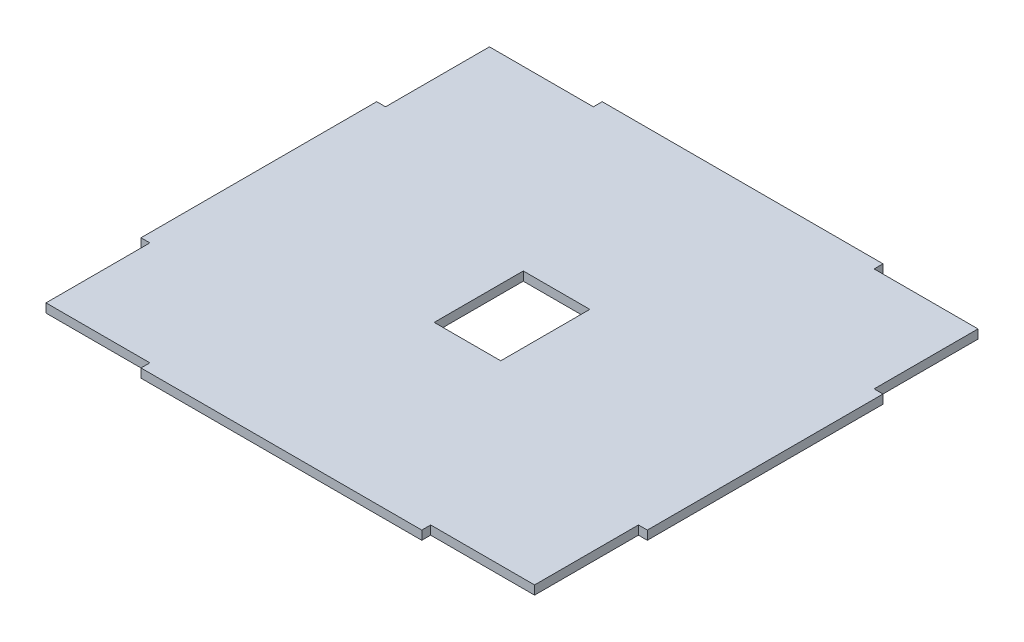
from build123d import *

# Parameters (mm, degrees)
SKETCH1_W           = 14.986
SKETCH1_H           = 20.066
BOSS_EXTRUDE1_DEPTH = 2


with BuildPart() as part:
    # Sketch1 → Boss-Extrude1 (new body)
    with BuildSketch(Plane(origin=(0, 0, 0), x_dir=(1, 0, 0), z_dir=(0, 1, 0))):
        Polygon((-55.023, 49.943), (-31.623, 49.943), (-31.623, 51.943), (31.623, 51.943), (31.623, 49.943), (55.023, 49.943), (55.023, 26.543), (57.023, 26.543), (57.023, -26.543), (55.023, -26.543), (55.023, -49.943), (31.623, -49.943), (31.623, -51.943), (-31.623, -51.943), (-31.623, -49.943), (-55.023, -49.943), (-55.023, -26.543), (-57.023, -26.543), (-57.023, 26.543), (-55.023, 26.543), align=None)
        Rectangle(SKETCH1_W, SKETCH1_H, mode=Mode.SUBTRACT)
    extrude(amount=BOSS_EXTRUDE1_DEPTH)


solid = part.part
